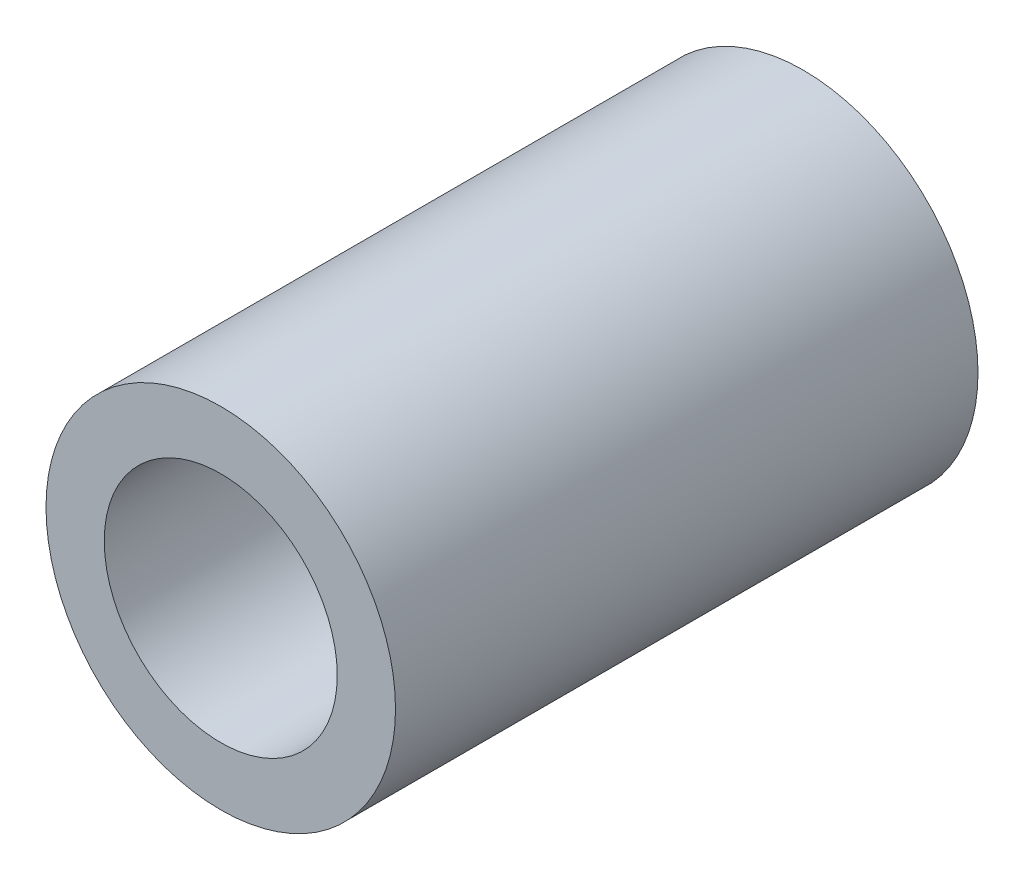
from build123d import *

# Parameters (mm, degrees)
SKETCH1_R           = 3.81
SKETCH1_R_2         = 2.54
BOSS_EXTRUDE1_DEPTH = 12.7
SKETCH1_2_R         = 2.54
BOSS_EXTRUDE2_DEPTH = 2.54


with BuildPart() as part:
    # Sketch1 → Boss-Extrude1 (new body)
    with BuildSketch(Plane.XY):
        Circle(SKETCH1_R)
        Circle(SKETCH1_R_2, mode=Mode.SUBTRACT)
    extrude(amount=BOSS_EXTRUDE1_DEPTH)

    # Sketch1<2> → Boss-Extrude2 (add)
    with BuildSketch(Plane.XY):
        Circle(SKETCH1_2_R)
    extrude(amount=BOSS_EXTRUDE2_DEPTH)


solid = part.part
